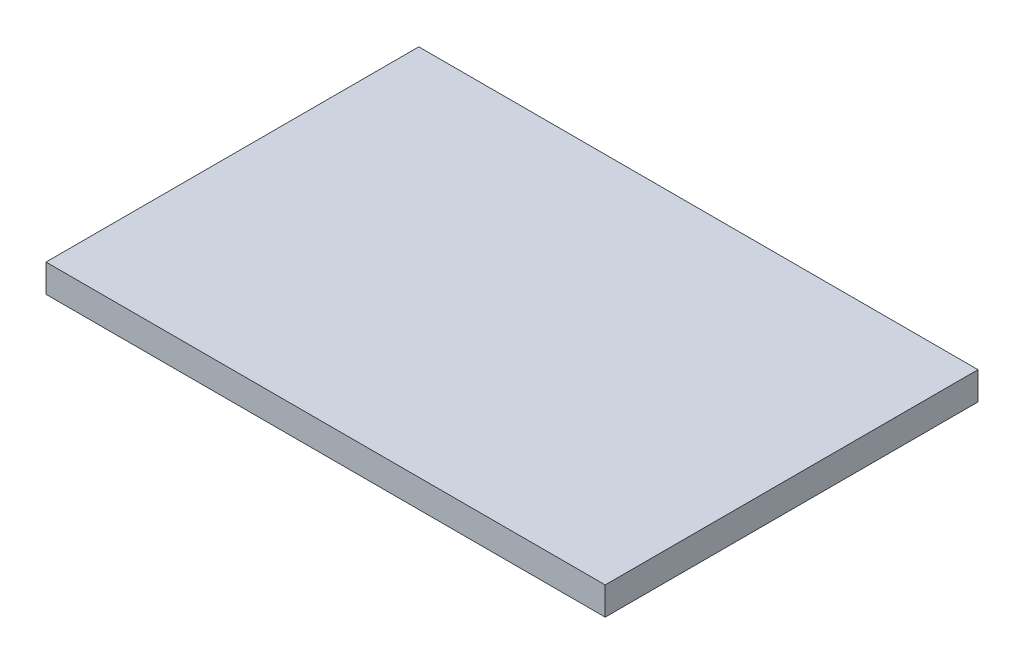
from build123d import *

# Parameters (mm, degrees)
SKETCH1_W           = 60
SKETCH1_H           = 40
BOSS_EXTRUDE1_DEPTH = 3


with BuildPart() as part:
    # Sketch1 → Boss-Extrude1 (new body)
    with BuildSketch(Plane(origin=(0, 0, 0), x_dir=(1, 0, 0), z_dir=(0, 1, 0))):
        Rectangle(SKETCH1_W, SKETCH1_H)
    extrude(amount=BOSS_EXTRUDE1_DEPTH)


solid = part.part
